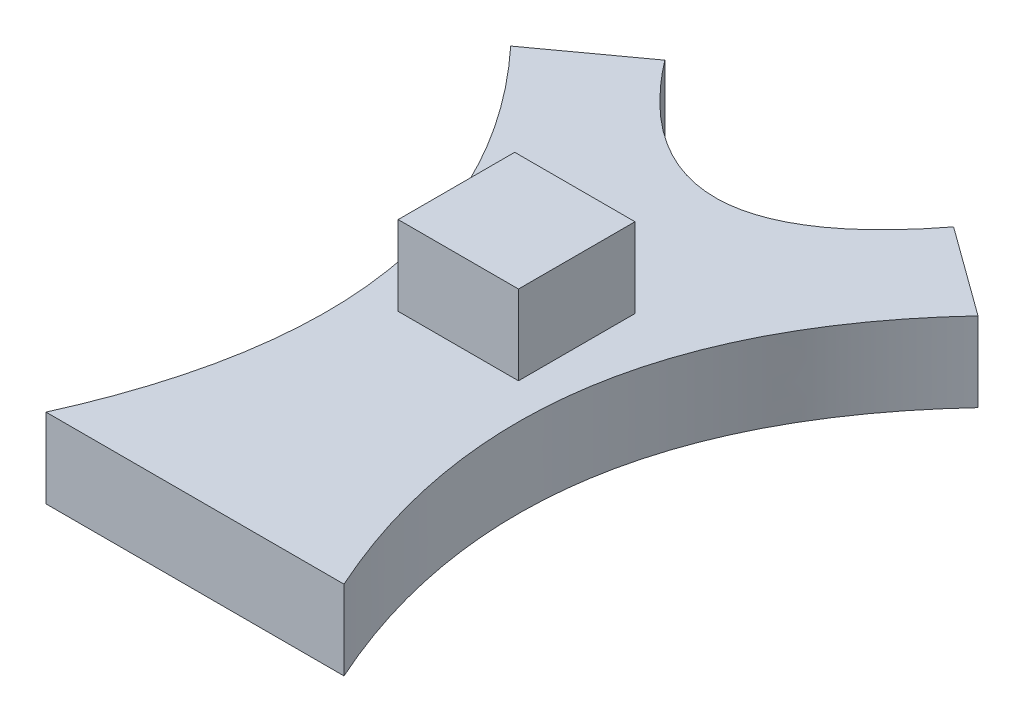
from build123d import *

# Parameters (mm, degrees)
BOSS_EXTRUDE1_DEPTH = 10
SKETCH2_W           = 15.13057465
SKETCH2_H           = 14.657745542
BOSS_EXTRUDE4_DEPTH = 10


with BuildPart() as part:
    # Sketch1 → Boss-Extrude1 (new body)
    with BuildSketch(Plane(origin=(0, 0, 0), x_dir=(1, 0, 0), z_dir=(0, 1, 0))):
        with BuildLine():
            Line((-18.741064285, -40.450849719), (18.741064285, -40.450849719))
            add(Edge.make_bspline(
                [(29.389262615, 28.647450844), (1.227704009, -1.534586439), (18.741064285, -40.450849719)],
                knots=[0, 0, 0, 1, 1, 1], degree=2))
            Line((29.389262615, 28.647450844), (18.1635632, 36.803398875))
            add(Edge.make_bspline(
                [(-18.1635632, 36.803398875), (0, 13.196601125), (18.1635632, 36.803398875)],
                knots=[0, 0, 0, 1, 1, 1], degree=2))
            Line((-18.1635632, 36.803398875), (-29.389262615, 28.647450844))
            add(Edge.make_bspline(
                [(-29.389262615, 28.647450844), (-1.227704009, -1.534586439), (-18.741064285, -40.450849719)],
                knots=[0, 0, 0, 1, 1, 1], degree=2))
        make_face()
    extrude(amount=BOSS_EXTRUDE1_DEPTH)

    # Sketch2 → Boss-Extrude4 (add)
    with BuildSketch(Plane(origin=(0, 10, 0), x_dir=(1, 0, 0), z_dir=(0, 1, 0))):
        Rectangle(SKETCH2_W, SKETCH2_H)
    extrude(amount=BOSS_EXTRUDE4_DEPTH)


solid = part.part
